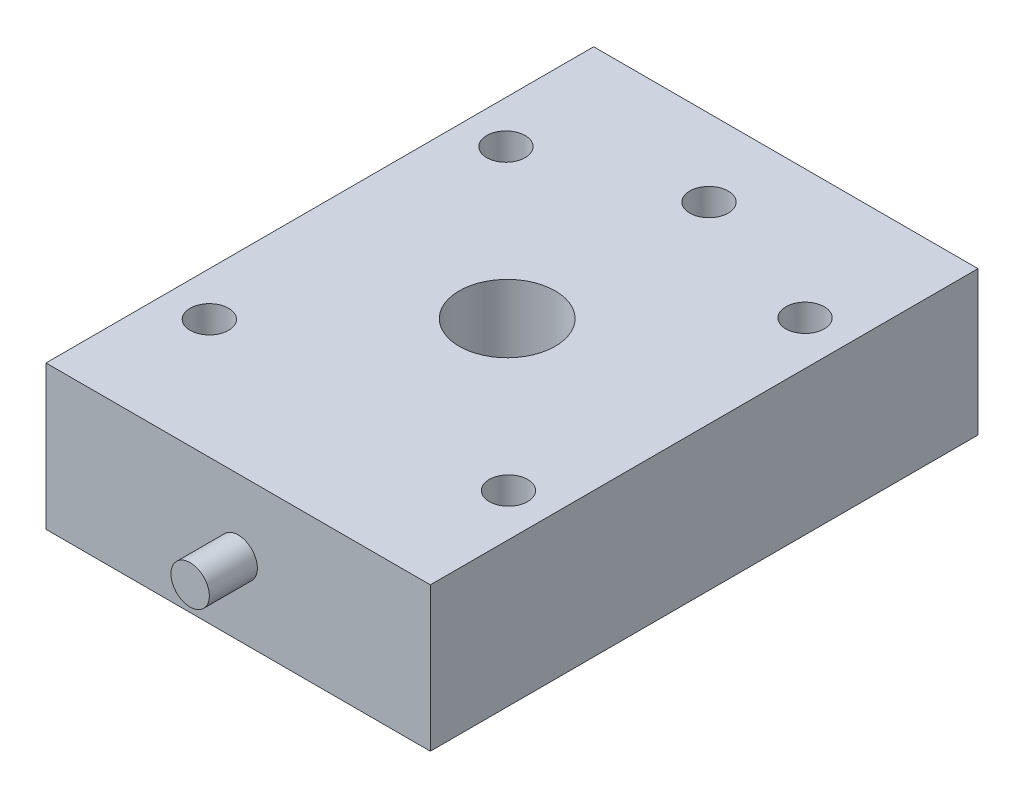
from build123d import *

# Parameters (mm, degrees)
SKETCH1_W           = 40
SKETCH1_H           = 15
BOSS_EXTRUDE1_DEPTH = 57
SKETCH2_R           = 2
BOSS_EXTRUDE2_DEPTH = 5
SKETCH3_R           = 2.5
CUT_EXTRUDE1_DEPTH  = 23
SKETCH5_R           = 2
CUT_EXTRUDE3_DEPTH  = 8
SKETCH7_R           = 5
CUT_EXTRUDE5_DEPTH  = 67.850579676
SKETCH8_R           = 2
CUT_EXTRUDE6_DEPTH  = 29


with BuildPart() as part:
    # Sketch1 → Boss-Extrude1 (new body)
    with BuildSketch(Plane.XY):
        Rectangle(SKETCH1_W, SKETCH1_H)
    extrude(amount=BOSS_EXTRUDE1_DEPTH)

    # Sketch2 → Boss-Extrude2 (add)
    with BuildSketch(Plane.XY.offset(57)):
        with Locations(Location((0, 0, 0), (0, 0, 180))):
            Circle(SKETCH2_R)
    extrude(amount=BOSS_EXTRUDE2_DEPTH)

    # Sketch3 → Cut-Extrude1 (cut)
    with BuildSketch(Plane(origin=(0, 0, 0), x_dir=(-1, 0, 0), z_dir=(0, 0, -1))):
        Circle(SKETCH3_R)
    extrude(amount=-CUT_EXTRUDE1_DEPTH, mode=Mode.SUBTRACT)

    # Sketch5 → Cut-Extrude3 (cut)
    with BuildSketch(Plane(origin=(0, 7.5, 0), x_dir=(1, 0, 0), z_dir=(0, 1, 0))):
        with Locations(Location((0, -8, 0), (0, 0, 270))):
            Circle(SKETCH5_R)
    extrude(amount=-CUT_EXTRUDE3_DEPTH, mode=Mode.SUBTRACT)

    # Sketch7 → Cut-Extrude5 (cut, through all)
    with BuildSketch(Plane(origin=(0, -7.5, 0), x_dir=(-1, 0, 0), z_dir=(0, -1, 0))):
        with Locations(Location((0, -29, 0), (0, 0, 90))):
            Circle(SKETCH7_R)
    extrude(amount=-CUT_EXTRUDE5_DEPTH, mode=Mode.SUBTRACT)

    # Sketch8 → Cut-Extrude6 (cut)
    with BuildSketch(Plane(origin=(0, -7.5, 0), x_dir=(-1, 0, 0), z_dir=(0, -1, 0))):
        with Locations(Location((-15.433459582, -13.433744017, 0), (0, 0, 90))):
            Circle(SKETCH8_R)
        with Locations(Location((-15.566255983, -44.433459582, 0), (0, 0, 90))):
            Circle(SKETCH8_R)
        with Locations(Location((15.433459582, -44.566255983, 0), (0, 0, 90))):
            Circle(SKETCH8_R)
        with Locations(Location((15.566255983, -13.566540418, 0), (0, 0, 90))):
            Circle(SKETCH8_R)
    extrude(amount=-CUT_EXTRUDE6_DEPTH, mode=Mode.SUBTRACT)


solid = part.part
